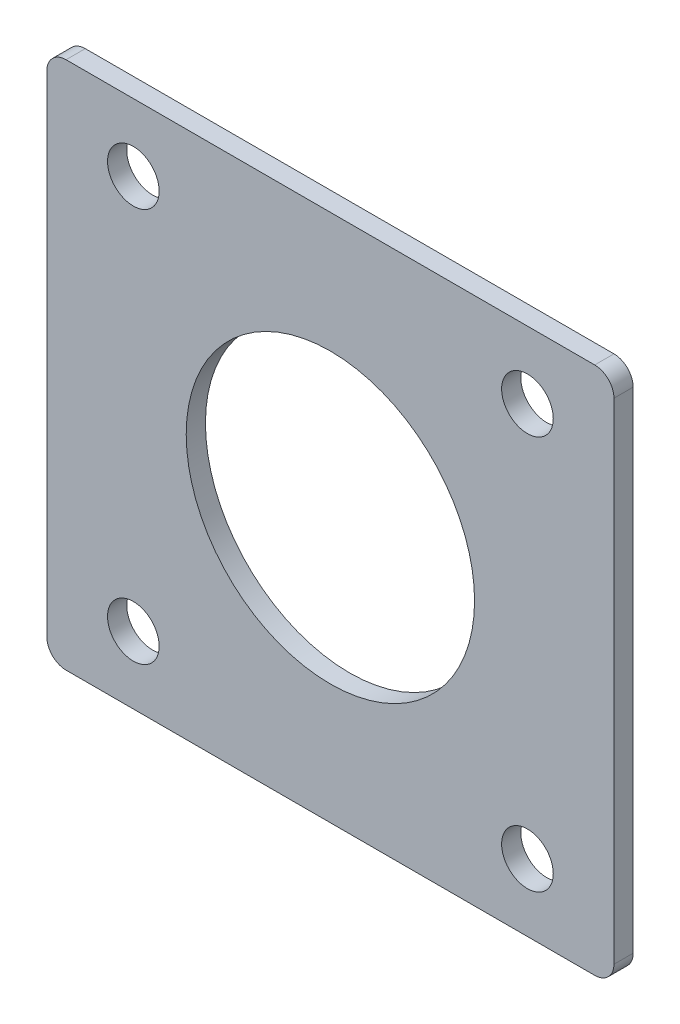
from build123d import *

# Parameters (mm, degrees)
SKETCH1_W      = 187.325
SKETCH1_H      = 174.625
SKETCH1_R      = 8.5328125
SKETCH1_R_2    = 47.625
EXTRUDE1_DEPTH = 6.35
FILLET1_R      = 6.35


with BuildPart() as part:
    # Sketch1 → Extrude1 (new body)
    with BuildSketch(Plane.XY):
        Rectangle(SKETCH1_W, SKETCH1_H)
        with Locations((-65.0875, 65.0875)):
            Circle(SKETCH1_R, mode=Mode.SUBTRACT)
        with Locations((65.0875, 65.0875)):
            Circle(SKETCH1_R, mode=Mode.SUBTRACT)
        with Locations((65.0875, -65.0875)):
            Circle(SKETCH1_R, mode=Mode.SUBTRACT)
        with Locations((-65.0875, -65.0875)):
            Circle(SKETCH1_R, mode=Mode.SUBTRACT)
        Circle(SKETCH1_R_2, mode=Mode.SUBTRACT)
    extrude(amount=EXTRUDE1_DEPTH)

    # Fillet1
    fillet1_edges = [part.edges().sort_by_distance(p)[0] for p in [
        (-93.6625, 87.3125, 3.175),
        (93.6625, 87.3125, 3.175),
        (93.6625, -87.3125, 3.175),
        (-93.6625, -87.3125, 3.175),
    ]]
    fillet(fillet1_edges, radius=FILLET1_R)


solid = part.part
